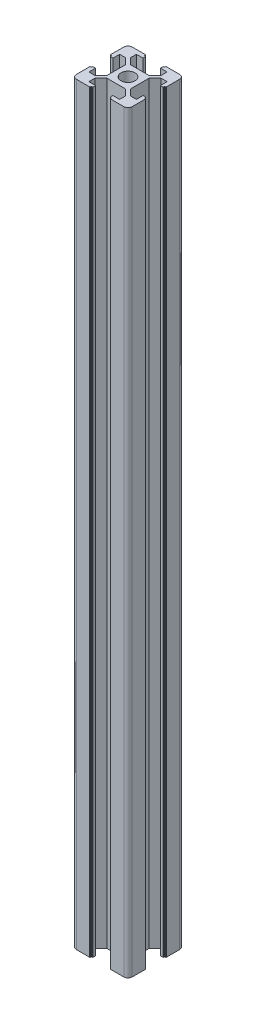
from build123d import *

# Parameters (mm, degrees)
BOSS_EXTRUDE1_DEPTH = 270
SKETCH3_R           = 2.5
CUT_EXTRUDE1_DEPTH  = 271.370116692
CIRPATTERN1_COUNT   = 4


with BuildPart() as part:
    # Sketch2 → Boss-Extrude1 (new body)
    with BuildSketch(Plane(origin=(0, 0, 0), x_dir=(1, 0, 0), z_dir=(0, 1, 0))):
        with BuildLine():
            Line((-10, -8.5), (-10, 8.5))
            ThreePointArc((-10, 8.5), (-9.560660172, 9.560660172), (-8.5, 10))
            Line((-8.5, 10), (8.5, 10))
            ThreePointArc((8.5, 10), (9.560660172, 9.560660172), (10, 8.5))
            Line((10, 8.5), (10, -8.5))
            ThreePointArc((10, -8.5), (9.560660172, -9.560660172), (8.5, -10))
            Line((8.5, -10), (-8.5, -10))
            ThreePointArc((-8.5, -10), (-9.560660172, -9.560660172), (-10, -8.5))
        make_face()
    extrude(amount=BOSS_EXTRUDE1_DEPTH)

    # Sketch3 → Cut-Extrude1 (cut, through all)
    with BuildSketch(Plane(origin=(0, 270, 0), x_dir=(1, 0, 0), z_dir=(0, 1, 0))):
        with BuildLine():
            Line((-6.348528137, -5.5), (-4.2, -3.351471863))
            Line((-4.2, -3.351471863), (-4.2, 3.351471863))
            Line((-4.2, 3.351471863), (-6.348528137, 5.5))
            Line((-6.348528137, 5.5), (-8.5, 5.5))
            Line((-8.5, 5.5), (-8.5, 3.1))
            Line((-8.5, 3.1), (-9.3, 3.1))
            ThreePointArc((-9.3, 3.1), (-9.441421356, 3.158578644), (-9.5, 3.3))
            Line((-9.5, 3.3), (-9.5, 3.6))
            Line((-9.5, 3.6), (-9.8, 3.6))
            ThreePointArc((-9.8, 3.6), (-9.941421356, 3.658578644), (-10, 3.8))
            Line((-10, 3.8), (-10, -3.8))
            ThreePointArc((-10, -3.8), (-9.941421356, -3.658578644), (-9.8, -3.6))
            Line((-9.8, -3.6), (-9.5, -3.6))
            Line((-9.5, -3.6), (-9.5, -3.3))
            ThreePointArc((-9.5, -3.3), (-9.441421356, -3.158578644), (-9.3, -3.1))
            Line((-9.3, -3.1), (-8.5, -3.1))
            Line((-8.5, -3.1), (-8.5, -5.5))
            Line((-8.5, -5.5), (-6.348528137, -5.5))
        make_face()
        Circle(SKETCH3_R)
    cut_extrude1 = extrude(amount=-CUT_EXTRUDE1_DEPTH, mode=Mode.SUBTRACT)

    # CirPattern1: Cut-Extrude1 ×4 about axis
    cirpattern1_axis = Axis((0, -20, 0), (0, 1, 0))
    for i in range(1, CIRPATTERN1_COUNT):
        add(cut_extrude1.rotate(cirpattern1_axis, i * 360 / CIRPATTERN1_COUNT), mode=Mode.SUBTRACT)


solid = part.part
